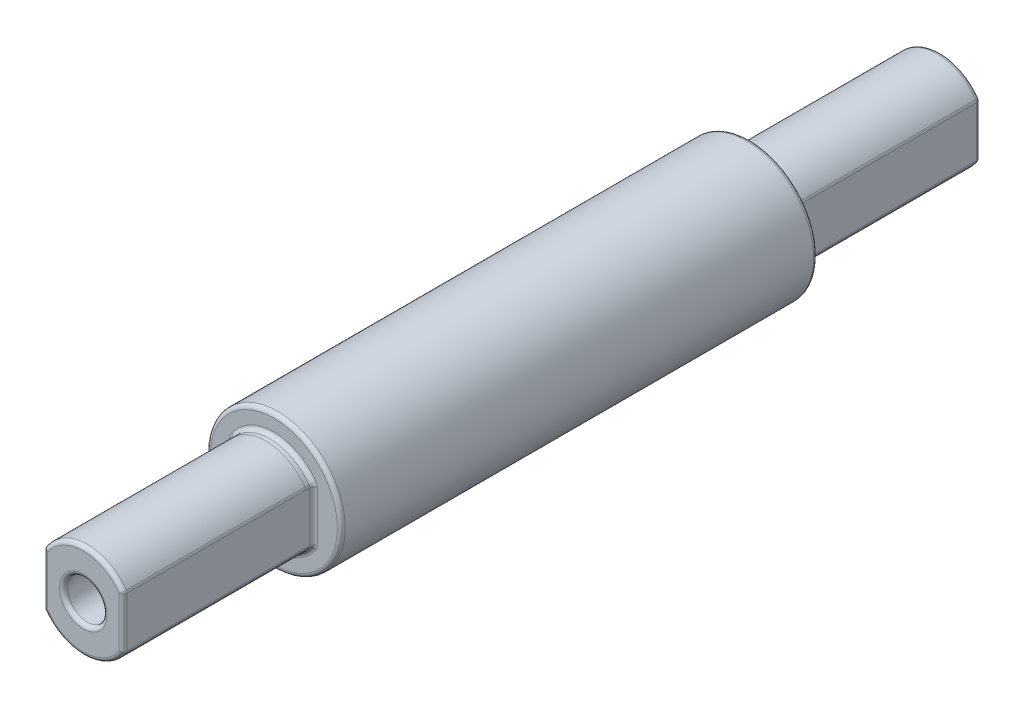
from build123d import *

# Parameters (mm, degrees)
CORTAR_EXTRUIR1_REACH = 57.322
REDONDEO2_R           = 0.5


with BuildPart() as part:
    # Croquis1 → Revolución4 (revolve)
    with BuildSketch(Plane(origin=(0, 0, 0), x_dir=(0, 0, -1), z_dir=(1, 0, 0)), mode=Mode.PRIVATE) as revoluci_n4_sk:
        Polygon((-30, 8.5), (-30, 6), (-31, 6), (-54, 6), (-54, 2.5), (-30, 2.5), (0, 2.5), (0, 8.5), align=None)
    revolve(revoluci_n4_sk.sketch.rotate(Axis((0, 0, 55.074829932), (0, 0, -1)), 90), axis=Axis((0, 0, 55.074829932), (0, 0, -1)))

    # Cortar-Extruir1: up to this face of the body (flat: up to its plane)
    cortar_extruir1_end = Plane(part.part.faces().sort_by_distance((-8.259583694, 0, 30))[0])
    # Croquis3 → Cortar-Extruir1 (cut, up to the picked face)
    with BuildSketch(Plane.XY.offset(54), mode=Mode.PRIVATE) as cortar_extruir1_sk1:
        with BuildLine():
            Line((-5, 3.31662479), (-5, -3.31662479))
            ThreePointArc((-5, -3.31662479), (-6, 0), (-5, 3.31662479))
        make_face()
    cortar_extruir1_tool1 = split(extrude(cortar_extruir1_sk1.sketch, amount=-CORTAR_EXTRUIR1_REACH, mode=Mode.PRIVATE), bisect_by=cortar_extruir1_end, keep=Keep.BOTH, mode=Mode.PRIVATE)
    # Croquis3 → Cortar-Extruir1 (cut, up to the picked face)
    with BuildSketch(Plane.XY.offset(54), mode=Mode.PRIVATE) as cortar_extruir1_sk2:
        with BuildLine():
            Line((5, 3.31662479), (5, -3.31662479))
            ThreePointArc((5, -3.31662479), (6, 0), (5, 3.31662479))
        make_face()
    cortar_extruir1_tool2 = split(extrude(cortar_extruir1_sk2.sketch, amount=-CORTAR_EXTRUIR1_REACH, mode=Mode.PRIVATE), bisect_by=cortar_extruir1_end, keep=Keep.BOTH, mode=Mode.PRIVATE)
    add(cortar_extruir1_tool1.solids().sort_by(Axis((-5.403002, 0, 54), (0, 0, -1)))[0], mode=Mode.SUBTRACT)
    add(cortar_extruir1_tool2.solids().sort_by(Axis((5.403002, 0, 54), (0, 0, -1)))[0], mode=Mode.SUBTRACT)

    # Redondeo2
    redondeo2_edges = [part.edges().sort_by_distance(p)[0] for p in [
        (0, -6, 54),
        (0, -6, 30),
        (5, 3.31662479, 42),
        (5, 0, 54),
        (5, 0, 30),
        (5, -3.31662479, 42),
        (5, -3.31662479, 42),
        (5, 3.31662479, 42),
        (-5, 0, 54),
        (-5, 0, 30),
        (-5, 3.31662479, 42),
        (-5, 3.31662479, 42),
        (-2.5, 0, 54),
        (0, 6, 54),
        (0, 6, 30),
        (-8.5, 0, 30),
    ]]
    fillet(redondeo2_edges, radius=REDONDEO2_R)

    # Simetría1: part across plane


with BuildPart() as part_1:
    add(part.part)
    add(part.part.mirror(Plane.XY))


solid = part_1.part
